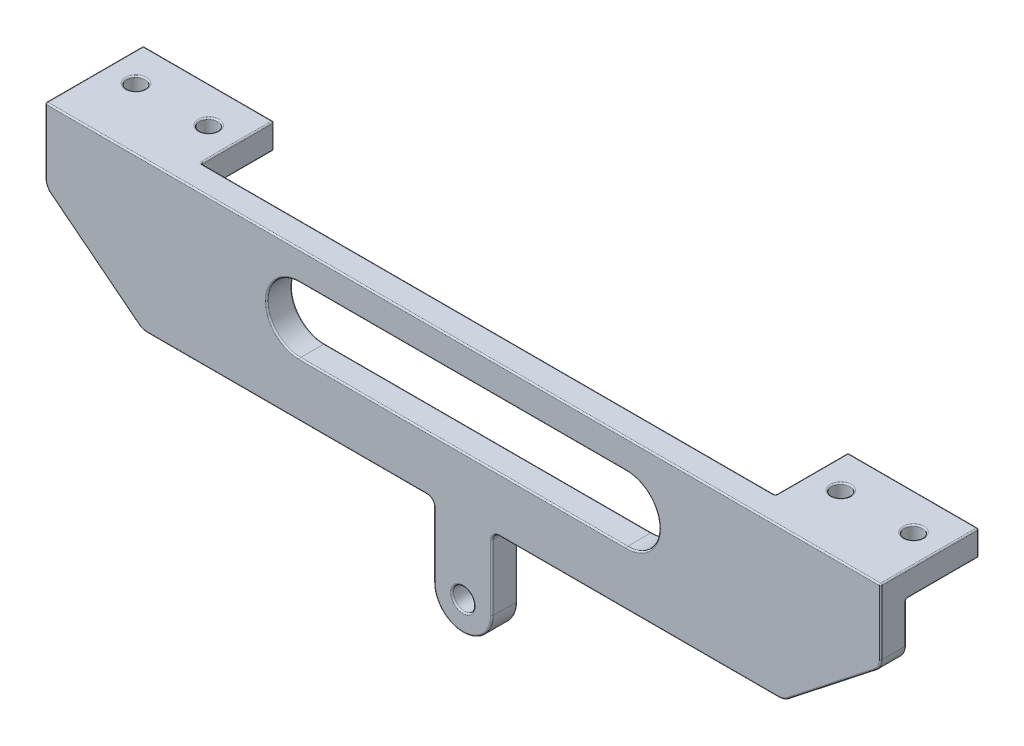
from build123d import *

# Parameters (mm, degrees)
SKETCH5_R           = 1.5
BOSS_EXTRUDE2_DEPTH = 3.5
SKETCH6_W           = 18
SKETCH6_H           = 10
SKETCH6_R           = 1.25
BOSS_EXTRUDE3_DEPTH = 3.5
FILLET1_R           = 2
FILLET2_R           = 1
FILLET3_R           = 0.2


with BuildPart() as part:
    # Sketch5 → Boss-Extrude2 (new body)
    with BuildSketch(Plane.XY):
        with BuildLine():
            Line((57.5, 80.5), (57.5, 90.5))
            Line((57.5, 90.5), (-57.5, 90.5))
            Line((-57.5, 90.5), (-57.5, 80.5))
            Line((-57.5, 80.5), (-44.142135624, 70))
            Line((-44.142135624, 70), (-4, 70))
            Line((-4, 70), (-4, 60))
            ThreePointArc((-4, 60), (0, 56), (4, 60))
            Line((4, 60), (4, 70))
            Line((4, 70), (44.142135624, 70))
            Line((44.142135624, 70), (57.5, 80.5))
        make_face()
        with Locations((0, 60)):
            Circle(SKETCH5_R, mode=Mode.SUBTRACT)
        with BuildLine():
            Line((22.5, 86.5), (-22.5, 86.5))
            ThreePointArc((-22.5, 86.5), (-27, 82), (-22.5, 77.5))
            Line((-22.5, 77.5), (22.5, 77.5))
            ThreePointArc((22.5, 77.5), (27, 82), (22.5, 86.5))
        make_face(mode=Mode.SUBTRACT)
    extrude(amount=BOSS_EXTRUDE2_DEPTH)

    # Sketch6 → Boss-Extrude3 (add)
    # profile 1 of 2: a face of its own
    with BuildSketch(Plane(origin=(0, 90.5, 0), x_dir=(1, 0, 0), z_dir=(0, 1, 0))):
        with Locations((-48.5, 5)):
            Rectangle(SKETCH6_W, SKETCH6_H)
        with Locations(Location((-53.5, 5, 0), (0, 0, 270))):
            Circle(SKETCH6_R, mode=Mode.SUBTRACT)
        with Locations(Location((-43.5, 5, 0), (0, 0, 270))):
            Circle(SKETCH6_R, mode=Mode.SUBTRACT)
    # profile 2 of 2: a face of its own
    with BuildSketch(Plane(origin=(0, 90.5, 0), x_dir=(1, 0, 0), z_dir=(0, 1, 0))):
        with Locations((48.5, 5)):
            Rectangle(SKETCH6_W, SKETCH6_H)
        with Locations(Location((43.5, 5, 0), (0, 0, 90))):
            Circle(SKETCH6_R, mode=Mode.SUBTRACT)
        with Locations(Location((53.5, 5, 0), (0, 0, 90))):
            Circle(SKETCH6_R, mode=Mode.SUBTRACT)
    extrude(amount=-BOSS_EXTRUDE3_DEPTH)

    # Fillet1
    fillet1_edges = [part.edges().sort_by_distance(p)[0] for p in [
        (57.5, 80.5, 1.75),
        (44.142135624, 70, 1.75),
        (-44.142135624, 70, 1.75),
        (-57.5, 80.5, 1.75),
    ]]
    fillet(fillet1_edges, radius=FILLET1_R)

    # Fillet2
    fillet2_edges = [part.edges().sort_by_distance(p)[0] for p in [
        (4, 70, 1.75),
        (-4, 70, 1.75),
    ]]
    fillet(fillet2_edges, radius=FILLET2_R)

    # Fillet3
    fillet3_edges = [part.edges().sort_by_distance(p)[0] for p in [
        (-4, 64.5, 0),
        (-4, 64.5, 3.5),
        (24.225087239, 70, 0),
        (24.225087239, 70, 3.5),
        (-4.292893219, 69.707106781, 0),
        (-4.292893219, 69.707106781, 3.5),
        (4.292893219, 69.707106781, 0),
        (4.292893219, 69.707106781, 3.5),
        (4, 64.5, 0),
        (0, 56, 0),
        (57.5, 90.5, -3.25),
        (-57.5, 90.5, -3.25),
        (0, 56, 3.5),
        (-1.5, 60, 0),
        (-1.5, 60, 3.5),
        (4, 64.5, 3.5),
        (-27, 82, 0),
        (0, 77.5, 0),
        (27, 82, 0),
        (0, 86.5, 0),
        (-27, 82, 3.5),
        (0, 77.5, 3.5),
        (27, 82, 3.5),
        (0, 86.5, 3.5),
        (-57.5, 84.235905547, 0),
        (0, 90.5, 3.5),
        (-57.5, 87, -5),
        (-48.5, 87, -10),
        (-57.5, 88.75, -10),
        (-39.5, 87, -5),
        (-39.5, 88.75, -10),
        (-48.5, 87, 0),
        (-39.5, 88.75, 0),
        (-43.5, 87, -6.25),
        (-53.5, 87, -6.25),
        (-39.5, 90.5, -5),
        (-48.5, 90.5, -10),
        (-53.5, 90.5, -6.25),
        (-43.5, 90.5, -6.25),
        (0, 90.5, 0),
        (57.5, 87, -5),
        (57.5, 88.75, -10),
        (48.5, 87, 0),
        (39.5, 87, -5),
        (39.5, 88.75, 0),
        (48.5, 87, -10),
        (39.5, 88.75, -10),
        (53.5, 87, -3.75),
        (43.5, 87, -3.75),
        (48.5, 90.5, -10),
        (39.5, 90.5, -5),
        (43.5, 90.5, -3.75),
        (53.5, 90.5, -3.75),
        (-24.225087239, 70, 0),
        (-24.225087239, 70, 3.5),
        (57.5, 84.235905547, 0),
        (50.711060386, 75.163528245, 0),
        (-50.711060386, 75.163528245, 0),
        (44.104103141, 70.109926641, 0),
        (57.298881082, 80.597724798, 0),
        (-57.298881082, 80.597724798, 0),
        (-44.104103141, 70.109926641, 0),
        (-50.711060386, 75.163528245, 3.5),
        (-57.5, 85.985905547, 3.5),
        (50.711060386, 75.163528245, 3.5),
        (57.5, 85.985905547, 3.5),
        (44.104103141, 70.109926641, 3.5),
        (57.298881082, 80.597724798, 3.5),
        (-57.298881082, 80.597724798, 3.5),
        (-44.104103141, 70.109926641, 3.5),
    ]]
    fillet(fillet3_edges, radius=FILLET3_R)


solid = part.part
